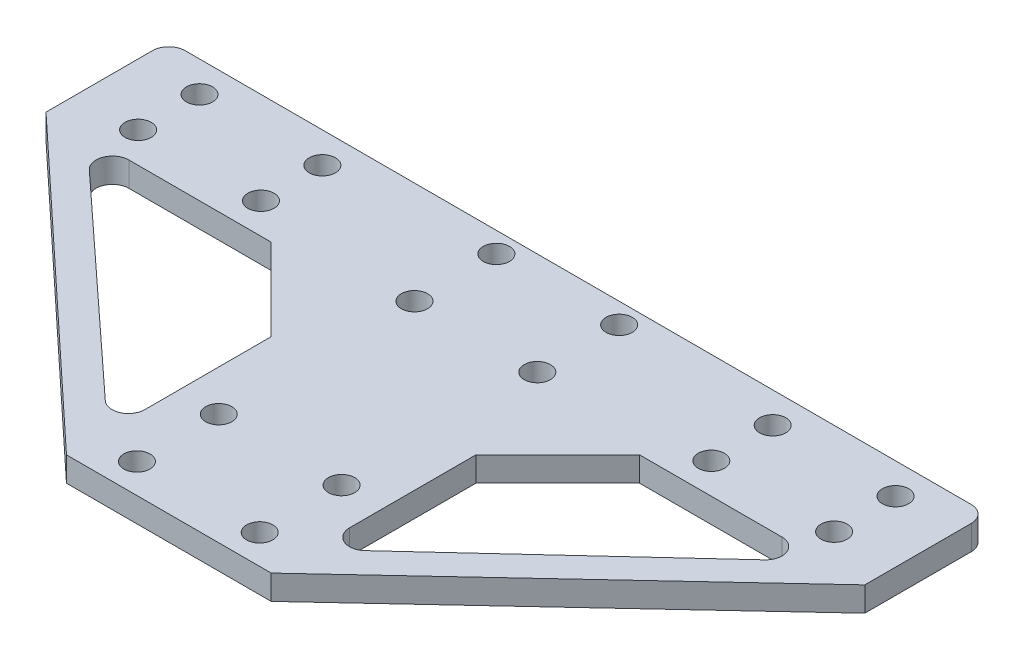
from build123d import *

# Parameters (mm, degrees)
SKETCH_1_W          = 100
SKETCH_1_H          = 15
EXTRUDE_1_DEPTH     = 3
SKETCH_2_W          = 25
SKETCH_2_H          = 50
EXTRUDE_2_DEPTH     = 3
SKETCH_3_R          = 1.6
CUT_EXTRUDE_1_DEPTH = 3
EXTRUDE_3_DEPTH     = 3
CHAMFER_1_SIZE      = 10
FILLET_2_R          = 2


with BuildPart() as part:
    # 草图1 → 凸台-拉伸1 (new body)
    with BuildSketch(Plane(origin=(0, 0, 0), x_dir=(1, 0, 0), z_dir=(0, 1, 0))):
        Rectangle(SKETCH_1_W, SKETCH_1_H)
    extrude(amount=EXTRUDE_1_DEPTH)

    # 草图2 → 凸台-拉伸2 (add)
    with BuildSketch(Plane(origin=(0, 3, 0), x_dir=(1, 0, 0), z_dir=(0, 1, 0))):
        with Locations((0, -17.5)):
            Rectangle(SKETCH_2_W, SKETCH_2_H)
    extrude(amount=-EXTRUDE_2_DEPTH)

    # 草图3 → 切除-拉伸1 (cut)
    with BuildSketch(Plane(origin=(0, 3, 0), x_dir=(1, 0, 0), z_dir=(0, 1, 0))):
        with Locations(Location((-42.5, 3.75, 0), (0, 0, 270))):
            Circle(SKETCH_3_R)
        with Locations(Location((-42.5, -3.75, 0), (0, 0, 90))):
            Circle(SKETCH_3_R)
        with Locations(Location((-27.5, -3.75, 0), (0, 0, 270))):
            Circle(SKETCH_3_R)
        with Locations(Location((-27.5, 3.75, 0), (0, 0, 90))):
            Circle(SKETCH_3_R)
        with Locations(Location((27.5, -3.75, 0), (0, 0, 90))):
            Circle(SKETCH_3_R)
        with Locations(Location((42.5, -3.75, 0), (0, 0, 270))):
            Circle(SKETCH_3_R)
        with Locations(Location((42.5, 3.75, 0), (0, 0, 90))):
            Circle(SKETCH_3_R)
        with Locations(Location((27.5, 3.75, 0), (0, 0, 270))):
            Circle(SKETCH_3_R)
        with Locations(Location((-7.5, 5, 0), (0, 0, 270))):
            Circle(SKETCH_3_R)
        with Locations(Location((-7.5, -5, 0), (0, 0, 90))):
            Circle(SKETCH_3_R)
        with Locations(Location((7.5, -5, 0), (0, 0, 270))):
            Circle(SKETCH_3_R)
        with Locations(Location((7.5, 5, 0), (0, 0, 90))):
            Circle(SKETCH_3_R)
        with Locations(Location((-7.5, -28.9, 0), (0, 0, 270))):
            Circle(SKETCH_3_R)
        with Locations(Location((-7.5, -38.9, 0), (0, 0, 90))):
            Circle(SKETCH_3_R)
        with Locations(Location((7.5, -38.9, 0), (0, 0, 270))):
            Circle(SKETCH_3_R)
        with Locations(Location((7.5, -28.9, 0), (0, 0, 90))):
            Circle(SKETCH_3_R)
    extrude(amount=-CUT_EXTRUDE_1_DEPTH, mode=Mode.SUBTRACT)

    # 草图4 → 凸台-拉伸3 (add)
    with BuildSketch(Plane(origin=(0, 3, 0), x_dir=(1, 0, 0), z_dir=(0, 1, 0))):
        Polygon((-50, -7.5), (-12.5, -42.5), (-12.5, -37.5), (-45, -7.5), align=None)
        Polygon((12.5, -37.5), (45, -7.5), (50, -7.5), (12.5, -42.5), align=None)
    extrude(amount=-EXTRUDE_3_DEPTH)

    # 倒角1
    chamfer_1_edges = [part.edges().sort_by_distance(p)[0] for p in [
        (-12.5, 1.5, 7.5),
        (12.5, 1.5, 7.5),
    ]]
    chamfer(chamfer_1_edges, length=CHAMFER_1_SIZE)

    # 圆角2
    fillet_2_edges = [part.edges().sort_by_distance(p)[0] for p in [
        (-45, 1.5, 7.5),
        (-12.5, 1.5, 37.5),
        (12.5, 1.5, 37.5),
        (45, 1.5, 7.5),
        (-50, 1.5, -7.5),
        (50, 1.5, -7.5),
    ]]
    fillet(fillet_2_edges, radius=FILLET_2_R)


solid = part.part
